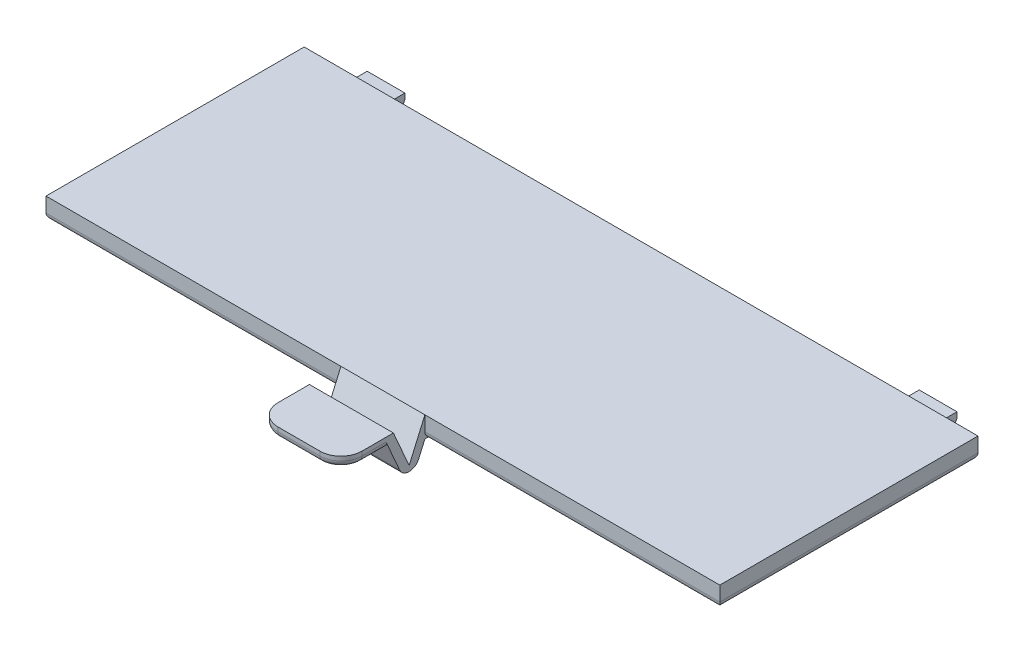
from build123d import *

# Parameters (mm, degrees)
CROQUIS1_W              = 32.1
CROQUIS1_H              = 12.3
SALIENTE_EXTRUIR1_DEPTH = 1
CROQUIS2_W              = 1.8
CROQUIS2_H              = 0.5
SALIENTE_EXTRUIR2_DEPTH = 1
SALIENTE_EXTRUIR3_DEPTH = 2
REDONDEO2_R             = 0.5
REDONDEO3_R             = 1
REDONDEO4_R             = 0.3
REDONDEO6_R             = 0.3


with BuildPart() as part:
    # Croquis1 → Saliente-Extruir1 (new body)
    with BuildSketch(Plane(origin=(0, 0, 0), x_dir=(1, 0, 0), z_dir=(0, 1, 0))):
        with Locations((0.329771615, 2.864192496)):
            Rectangle(CROQUIS1_W, CROQUIS1_H)
    extrude(amount=SALIENTE_EXTRUIR1_DEPTH)

    # Croquis2 → Saliente-Extruir2 (add)
    with BuildSketch(Plane(origin=(-6.706035889, 0, -9.014192496), x_dir=(1, 0, 0), z_dir=(0, 0, 1))):
        with Locations((-6.114192496, 0.25)):
            Rectangle(CROQUIS2_W, CROQUIS2_H)
        with Locations((20.185807504, 0.25)):
            Rectangle(CROQUIS2_W, CROQUIS2_H)
    extrude(amount=-SALIENTE_EXTRUIR2_DEPTH)

    # Croquis4 → Saliente-Extruir3 (add, symmetric)
    with BuildSketch(Plane.ZY.offset(-0.329771615)):
        Polygon((3.285807504, 1), (3.285807504, 0), (4.035807504, -1.718465886), (5.004025394, 0.5), (7.285807504, 0.5), (7.285807504, 1), (4.785807504, 1), (4.035807504, -0.718465886), align=None)
    extrude(amount=SALIENTE_EXTRUIR3_DEPTH, both=True)

    # Redondeo2
    redondeo2_edges = [part.edges().sort_by_distance(p)[0] for p in [
        (0.329771615, -1.718465886, 4.035807504),
    ]]
    fillet(redondeo2_edges, radius=REDONDEO2_R)

    # Redondeo3
    redondeo3_edges = [part.edges().sort_by_distance(p)[0] for p in [
        (2.329771615, 0.75, 7.285807504),
        (-1.670228385, 0.75, 7.285807504),
    ]]
    fillet(redondeo3_edges, radius=REDONDEO3_R)

    # Redondeo4
    redondeo4_edges = [part.edges().sort_by_distance(p)[0] for p in [
        (2.329771615, 0.5, 5.644916449),
        (-1.670228385, 0.5, 5.644916449),
        (0.329771615, 0.5, 7.285807504),
        (2.036878396, 0.5, 6.992914285),
        (-1.377335166, 0.5, 6.992914285),
    ]]
    fillet(redondeo4_edges, radius=REDONDEO4_R)

    # Redondeo6
    redondeo6_edges = [part.edges().sort_by_distance(p)[0] for p in [
        (-14.720228385, 0, -9.014192496),
        (-12.820228385, 0, -10.014192496),
        (0.329771615, 0, -9.014192496),
        (13.479771615, 0, -10.014192496),
        (9.354771615, 0, 3.285807504),
        (15.379771615, 0, -9.014192496),
        (16.379771615, 0, -2.864192496),
        (-8.695228385, 0, 3.285807504),
        (-15.720228385, 0, -2.864192496),
    ]]
    fillet(redondeo6_edges, radius=REDONDEO6_R)


solid = part.part
